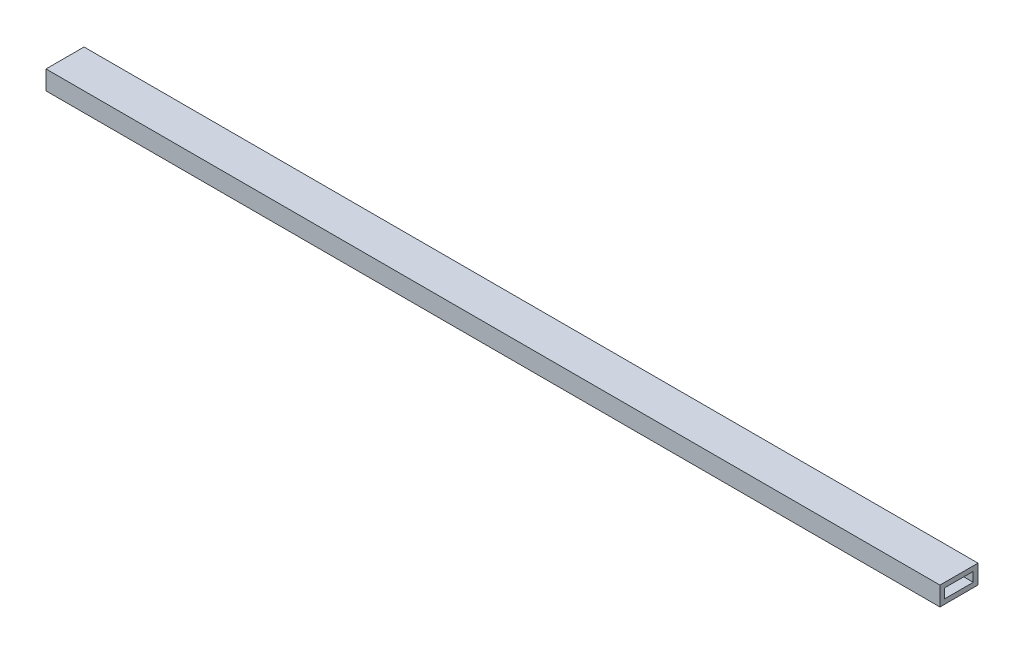
from build123d import *

# Parameters (mm, degrees)
SKETCH1_W           = 25.4
SKETCH1_H           = 12.7
SKETCH1_W_2         = 19.05
SKETCH1_H_2         = 6.35
EXTRUDE_THIN1_DEPTH = 596.9


with BuildPart() as part:
    # Sketch1 → Extrude-Thin1 (new body)
    with BuildSketch(Plane(origin=(0, 0, 0), x_dir=(0, 0, -1), z_dir=(1, 0, 0))):
        with Locations((12.7, 6.35)):
            Rectangle(SKETCH1_W, SKETCH1_H)
        with Locations((12.7, 6.35)):
            Rectangle(SKETCH1_W_2, SKETCH1_H_2, mode=Mode.SUBTRACT)
    extrude(amount=EXTRUDE_THIN1_DEPTH)


solid = part.part
